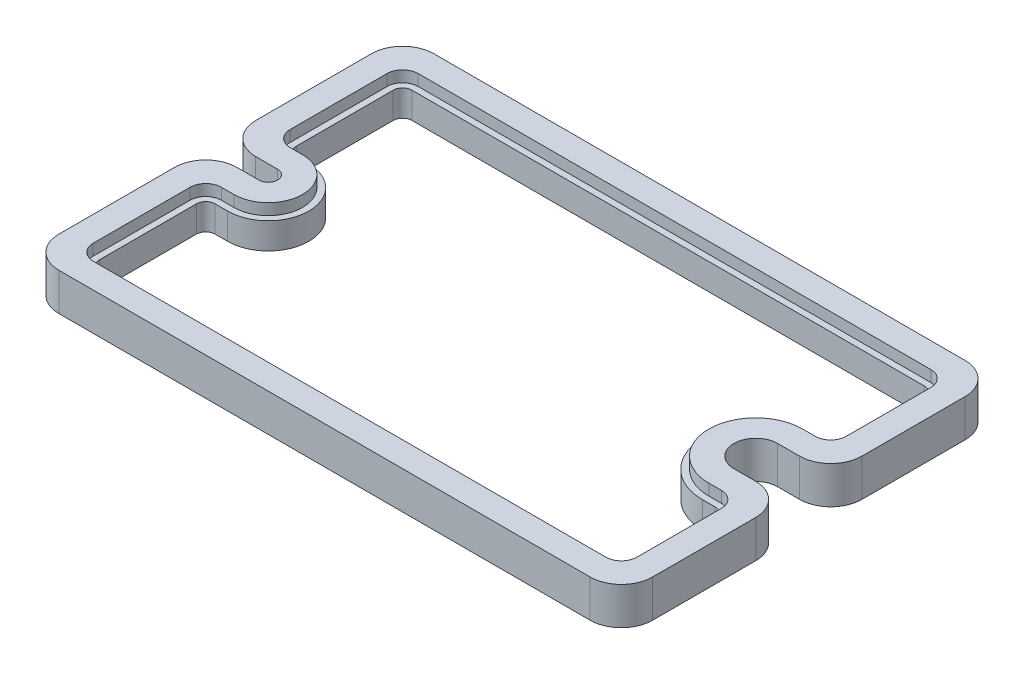
from build123d import *

# Parameters (mm, degrees)
SKETCH1_W           = 95
SKETCH1_H           = 60
BOSS_EXTRUDE1_DEPTH = 6
SKETCH6_R           = 3.5
SKETCH6_R_2         = 1.5
CUT_EXTRUDE3_DEPTH  = 113.521109131
CUT_EXTRUDE1_DEPTH  = 113.521109131
FILLET3_R           = 1.5
SKETCH7_W           = 8.5
SKETCH7_H           = 3
SKETCH7_H_2         = 7
CUT_EXTRUDE4_DEPTH  = 113.521109131
FILLET4_R           = 5
FILLET5_R           = 1.5
CUT_EXTRUDE5_DEPTH  = 1.8


with BuildPart() as part:
    # Sketch1 → Boss-Extrude1 (new body)
    with BuildSketch(Plane(origin=(0, 0, 0), x_dir=(1, 0, 0), z_dir=(0, 1, 0))):
        with Locations((47.5, 30)):
            Rectangle(SKETCH1_W, SKETCH1_H)
    extrude(amount=BOSS_EXTRUDE1_DEPTH)

    # Sketch6 → Cut-Extrude3 (cut, through all)
    with BuildSketch(Plane.XZ):
        with Locations(Location((86.5, -30, 0), (0, 0, 270))):
            Circle(SKETCH6_R)
        with Locations(Location((8.5, -30, 0), (0, 0, 270))):
            Circle(SKETCH6_R_2)
    extrude(amount=-CUT_EXTRUDE3_DEPTH, mode=Mode.SUBTRACT)

    # Sketch2 → Cut-Extrude1 (cut, through all)
    with BuildSketch(Plane(origin=(0, 6, 0), x_dir=(-1, 0, 0), z_dir=(0, 1, 0))):
        with BuildLine():
            Line((-8.5, -36.5), (-5, -36.5))
            Line((-5, -36.5), (-5, -55))
            Line((-5, -55), (-90, -55))
            Line((-90, -55), (-90, -38.5))
            Line((-90, -38.5), (-86.5, -38.5))
            ThreePointArc((-86.5, -38.5), (-78, -30), (-86.5, -21.5))
            Line((-86.5, -21.5), (-90, -21.5))
            Line((-90, -21.5), (-90, -5))
            Line((-90, -5), (-5, -5))
            Line((-5, -5), (-5, -23.5))
            Line((-5, -23.5), (-8.5, -23.5))
            ThreePointArc((-8.5, -23.5), (-15, -30), (-8.5, -36.5))
        make_face()
    extrude(amount=-CUT_EXTRUDE1_DEPTH, mode=Mode.SUBTRACT)

    # Fillet3
    fillet3_edges = [part.edges().sort_by_distance(p)[0] for p in [
        (90, 3, -55),
    ]]
    fillet(fillet3_edges, radius=FILLET3_R)

    # Sketch7 → Cut-Extrude4 (cut, through all)
    with BuildSketch(Plane(origin=(0, 6, 0), x_dir=(-1, 0, 0), z_dir=(0, 1, 0))):
        with Locations((-4.25, -30)):
            Rectangle(SKETCH7_W, SKETCH7_H)
        with Locations((-90.75, -30)):
            Rectangle(SKETCH7_W, SKETCH7_H_2)
    extrude(amount=-CUT_EXTRUDE4_DEPTH, mode=Mode.SUBTRACT)

    # Fillet4
    fillet4_edges = [part.edges().sort_by_distance(p)[0] for p in [
        (0, 3, -60),
        (95, 3, -60),
        (0, 3, -28.5),
        (95, 3, 0),
        (0, 3, -31.5),
        (0, 3, 0),
        (95, 3, -33.5),
        (95, 3, -26.5),
    ]]
    fillet(fillet4_edges, radius=FILLET4_R)

    # Fillet5
    fillet5_edges = [part.edges().sort_by_distance(p)[0] for p in [
        (5, 3, -5),
        (5, 3, -23.5),
        (5, 3, -36.5),
        (5, 3, -55),
        (90, 3, -38.5),
        (90, 3, -21.5),
        (90, 3, -5),
    ]]
    fillet(fillet5_edges, radius=FILLET5_R)

    # Sketch9 → Cut-Extrude5 (cut)
    with BuildSketch(Plane(origin=(0, 6, 0), x_dir=(1, 0, 0), z_dir=(0, 1, 0))):
        with BuildLine():
            Line((6.5, 4), (88.5, 4))
            ThreePointArc((88.5, 4), (90.267766953, 4.732233047), (91, 6.5))
            Line((91, 6.5), (91, 20))
            ThreePointArc((91, 20), (90.267766953, 21.767766953), (88.5, 22.5))
            Line((88.5, 22.5), (86.5, 22.5))
            ThreePointArc((86.5, 22.5), (79, 30), (86.5, 37.5))
            Line((86.5, 37.5), (88.5, 37.5))
            ThreePointArc((88.5, 37.5), (90.267766953, 38.232233047), (91, 40))
            Line((91, 40), (91, 53.5))
            ThreePointArc((91, 53.5), (90.267766953, 55.267766953), (88.5, 56))
            Line((88.5, 56), (6.5, 56))
            ThreePointArc((6.5, 56), (4.732233047, 55.267766953), (4, 53.5))
            Line((4, 53.5), (4, 38))
            ThreePointArc((4, 38), (4.732233047, 36.232233047), (6.5, 35.5))
            Line((6.5, 35.5), (8.5, 35.5))
            ThreePointArc((8.5, 35.5), (14, 30), (8.5, 24.5))
            Line((8.5, 24.5), (6.5, 24.5))
            ThreePointArc((6.5, 24.5), (4.732233047, 23.767766953), (4, 22))
            Line((4, 22), (4, 6.5))
            ThreePointArc((4, 6.5), (4.732233047, 4.732233047), (6.5, 4))
        make_face()
    extrude(amount=-CUT_EXTRUDE5_DEPTH, mode=Mode.SUBTRACT)


solid = part.part
